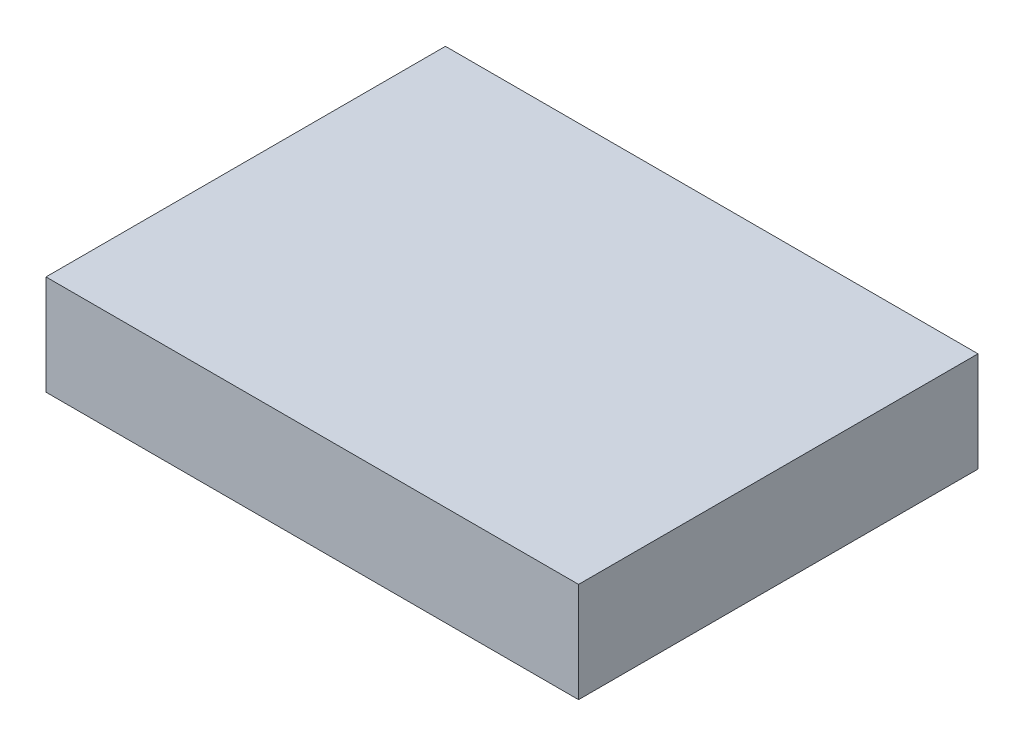
from build123d import *

# Parameters (mm, degrees)
SKETCH14_W     = 101.6
SKETCH14_H     = 76.2
EXTRUDE5_DEPTH = 19.05


with BuildPart() as part:
    # Sketch14 → Extrude5 (new body)
    with BuildSketch(Plane(origin=(0, 0, 0), x_dir=(1, 0, 0), z_dir=(0, 1, 0))):
        with Locations((50.8, 38.1)):
            Rectangle(SKETCH14_W, SKETCH14_H)
    extrude(amount=-EXTRUDE5_DEPTH)


solid = part.part
